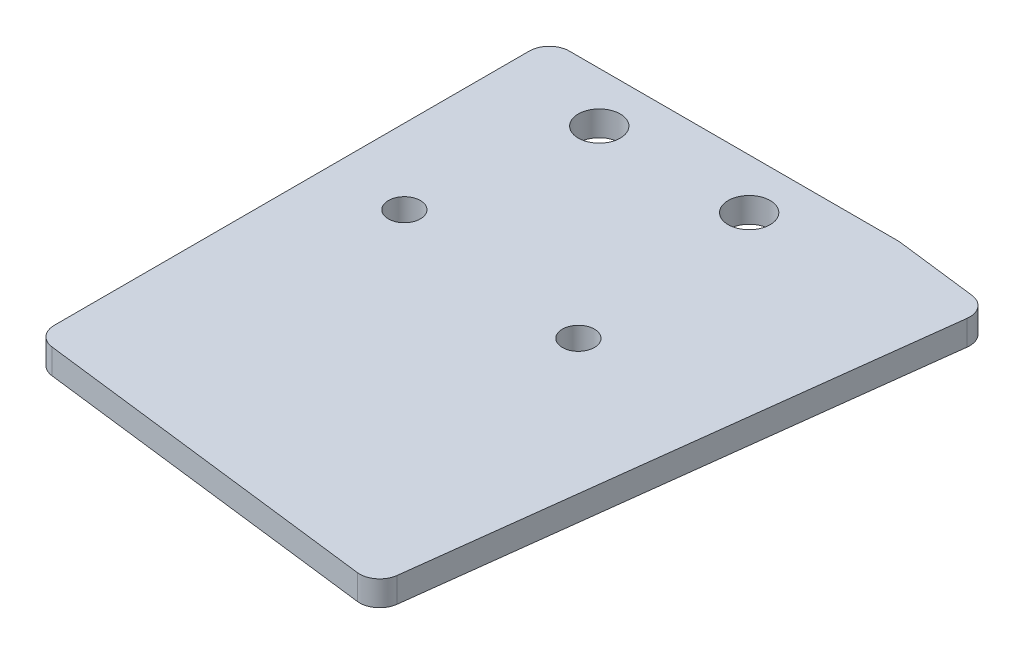
from build123d import *

# Parameters (mm, degrees)
SKETCH_1_W      = 35
SKETCH_1_H      = 10
SKETCH_1_R      = 2.1
EXTRUDE_1_DEPTH = 2.5
SKETCH_3_R      = 1.6
EXTRUDE_2_DEPTH = 2.5
EXTRUDE_3_DEPTH = 2.5
FILLET_1_R      = 2


with BuildPart() as part:
    # 草图1 → 凸台-拉伸1 (new body)
    with BuildSketch(Plane(origin=(0, 0, 0), x_dir=(1, 0, 0), z_dir=(0, 1, 0))):
        Rectangle(SKETCH_1_W, SKETCH_1_H)
        with Locations(Location((-7.5, 0, 0), (0, 0, 270))):
            Circle(SKETCH_1_R, mode=Mode.SUBTRACT)
        with Locations(Location((7.5, 0, 0), (0, 0, 270))):
            Circle(SKETCH_1_R, mode=Mode.SUBTRACT)
    extrude(amount=EXTRUDE_1_DEPTH)

    # 草图3 → 凸台-拉伸2 (add)
    with BuildSketch(Plane(origin=(0, 2.5, 0), x_dir=(1, 0, 0), z_dir=(0, 1, 0))):
        Polygon((-17.5, -5), (17.5, -5), (17.5, -50.601870189), (-17.5, -46.304410557), align=None)
        with Locations(Location((-10, -17, 0), (0, 0, 270))):
            Circle(SKETCH_3_R, mode=Mode.SUBTRACT)
        with Locations(Location((9.850923033, -19.437386868, 0), (0, 0, 270))):
            Circle(SKETCH_3_R, mode=Mode.SUBTRACT)
    extrude(amount=-EXTRUDE_2_DEPTH)

    # 草图4 → 凸台-拉伸3 (add)
    with BuildSketch(Plane(origin=(0, 2.5, 0), x_dir=(1, 0, 0), z_dir=(0, 1, 0))):
        Polygon((21.083035005, -51.041811568), (27.808689923, 3.734252034), (17.5, 5), (17.5, -50.601870189), align=None)
    extrude(amount=-EXTRUDE_3_DEPTH)

    # 圆角1
    fillet_1_edges = [part.edges().sort_by_distance(p)[0] for p in [
        (-17.5, 1.25, 46.304410557),
        (21.083035005, 1.25, 51.041811568),
        (27.808689923, 1.25, -3.734252034),
        (-17.5, 1.25, -5),
        (17.5, 1.25, -5),
    ]]
    fillet(fillet_1_edges, radius=FILLET_1_R)


solid = part.part
